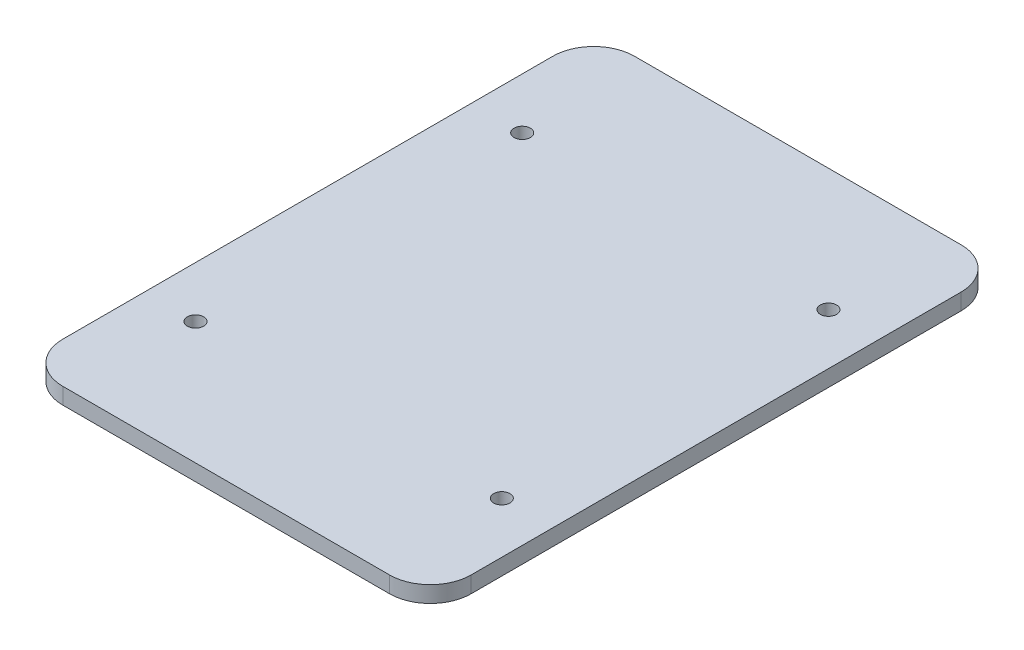
from build123d import *

# Parameters (mm, degrees)
SKETCH_1_W      = 100
SKETCH_1_H      = 140
SKETCH_1_R      = 2
EXTRUDE_1_DEPTH = 4
FILLET_1_R      = 10


with BuildPart() as part:
    # 草图1 → 凸台-拉伸1 (new body)
    with BuildSketch(Plane(origin=(0, 0, 0), x_dir=(1, 0, 0), z_dir=(0, 1, 0))):
        Rectangle(SKETCH_1_W, SKETCH_1_H)
        with Locations(Location((-37.5, 40, 0), (0, 0, 270))):
            Circle(SKETCH_1_R, mode=Mode.SUBTRACT)
        with Locations(Location((37.5, 40, 0), (0, 0, 270))):
            Circle(SKETCH_1_R, mode=Mode.SUBTRACT)
        with Locations(Location((37.5, -40, 0), (0, 0, 270))):
            Circle(SKETCH_1_R, mode=Mode.SUBTRACT)
        with Locations(Location((-37.5, -40, 0), (0, 0, 270))):
            Circle(SKETCH_1_R, mode=Mode.SUBTRACT)
    extrude(amount=EXTRUDE_1_DEPTH)

    # 圆角1
    fillet_1_edges = [part.edges().sort_by_distance(p)[0] for p in [
        (50, 2, 70),
        (-50, 2, 70),
        (-50, 2, -70),
        (50, 2, -70),
    ]]
    fillet(fillet_1_edges, radius=FILLET_1_R)


solid = part.part
